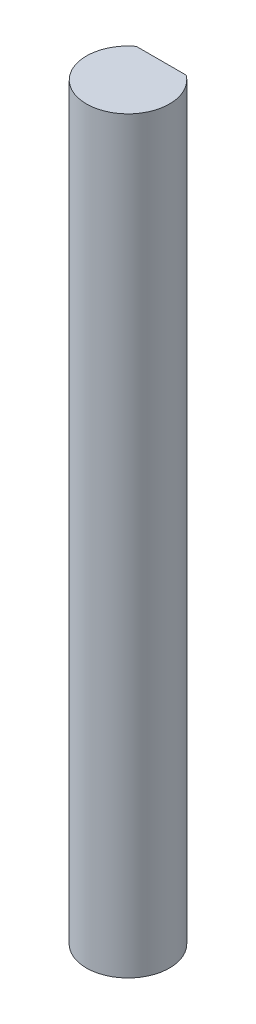
from build123d import *

# Parameters (mm, degrees)
EXTRUDE_1_DEPTH = 45


with BuildPart() as part:
    # 草图1 → 凸台-拉伸1 (new body)
    with BuildSketch(Plane(origin=(0, 0, 0), x_dir=(1, 0, 0), z_dir=(0, 1, 0))):
        with BuildLine():
            Line((0, 2), (-1.5, 2))
            ThreePointArc((-1.5, 2), (-2.371708245, -0.790569415), (0, -2.5))
            Line((0, -2.5), (0, 2))
        make_face()
        with BuildLine():
            Line((1.5, 2), (0, 2))
            Line((0, 2), (0, -2.5))
            ThreePointArc((0, -2.5), (1.767766953, -1.767766953), (2.5, 0))
            ThreePointArc((2.5, 0), (2.236067977, 1.118033989), (1.5, 2))
        make_face()
    extrude(amount=EXTRUDE_1_DEPTH)


solid = part.part
